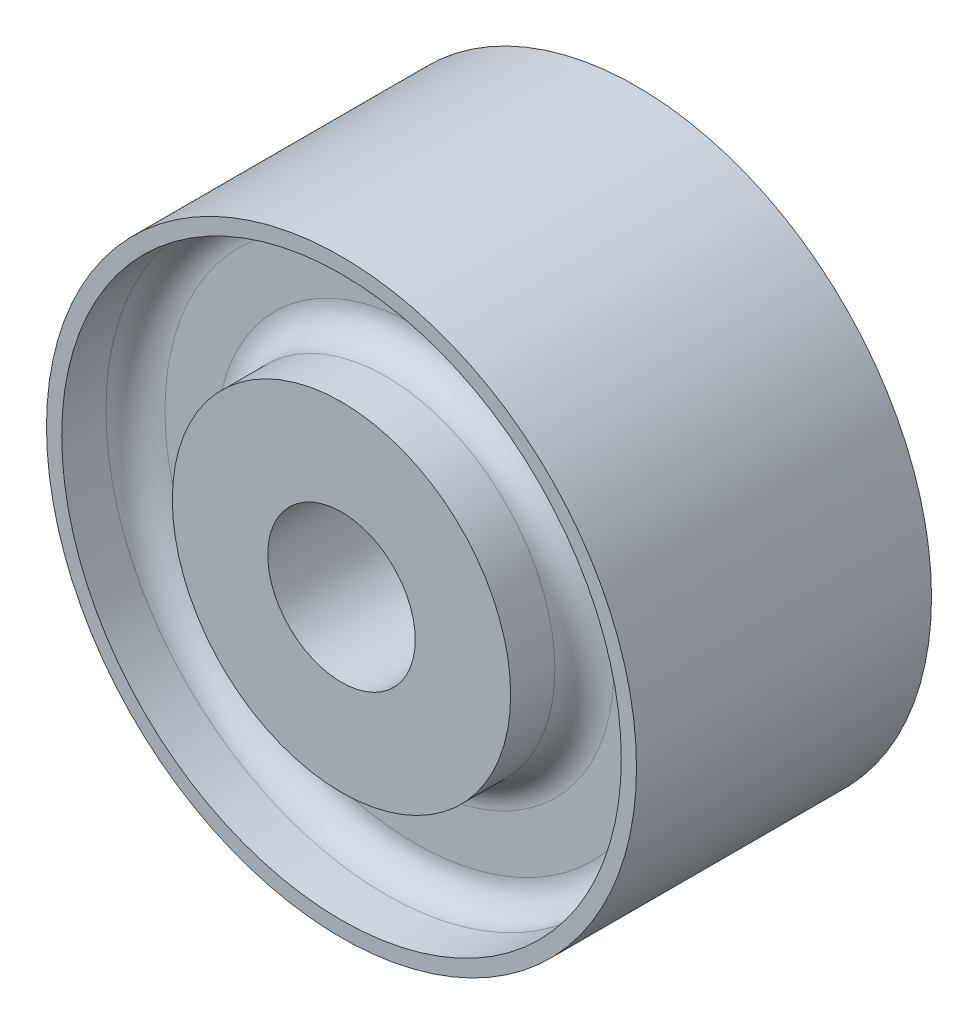
from build123d import *

# Parameters (mm, degrees)
BOSS_EXTRUDE1_DEPTH      = 25.4
BOSS_EXTRUDE1_DEPTH_BACK = 25.4
SKETCH1_R                = 50.8
SKETCH3_R                = 12.7
CUT_EXTRUDE2_DEPTH       = 88.988181024


with BuildPart() as part:
    # Sketch1 → Boss-Extrude1 (new, two sides: drawn at the far end of the back side and taken through both)
    with BuildSketch(Plane.XY.offset(-BOSS_EXTRUDE1_DEPTH_BACK)):
        Circle(SKETCH1_R)
    extrude(amount=BOSS_EXTRUDE1_DEPTH + BOSS_EXTRUDE1_DEPTH_BACK)

    # Sketch3 → Cut-Extrude2 (cut, through all)
    with BuildSketch(Plane.XY.offset(25.4)):
        Circle(SKETCH3_R)
    extrude(amount=-CUT_EXTRUDE2_DEPTH, mode=Mode.SUBTRACT)

    # Cut-Sweep1: sweep along a path in Sketch4
    with BuildLine(Plane.XY.offset(25.4)) as cut_sweep1_path:
        CenterArc((0, 0), 38.1, 0, 360)
    # Sketch7 → Cut-Sweep1 (sweep, cut)
    with BuildSketch(Plane(origin=(0, 0, 0), x_dir=(0, 0, -1), z_dir=(1, 0, 0))):
        with BuildLine():
            Line((-25.4, 48.177038495), (-17.78, 48.177038495))
            ThreePointArc((-17.78, 48.177038495), (-14.187897552, 46.689140943), (-12.7, 43.097038495))
            Line((-12.7, 43.097038495), (-12.7, 34.207038495))
            ThreePointArc((-12.7, 34.207038495), (-14.187897552, 30.614936046), (-17.78, 29.127038495))
            Line((-17.78, 29.127038495), (-25.4, 29.127038495))
            Line((-25.4, 29.127038495), (-25.4, 48.177038495))
        make_face()
    cut_sweep1 = sweep(path=cut_sweep1_path.line, mode=Mode.SUBTRACT)

    # Mirror1: Cut-Sweep1 across plane
    add(cut_sweep1.mirror(Plane.XY), mode=Mode.SUBTRACT)


solid = part.part
